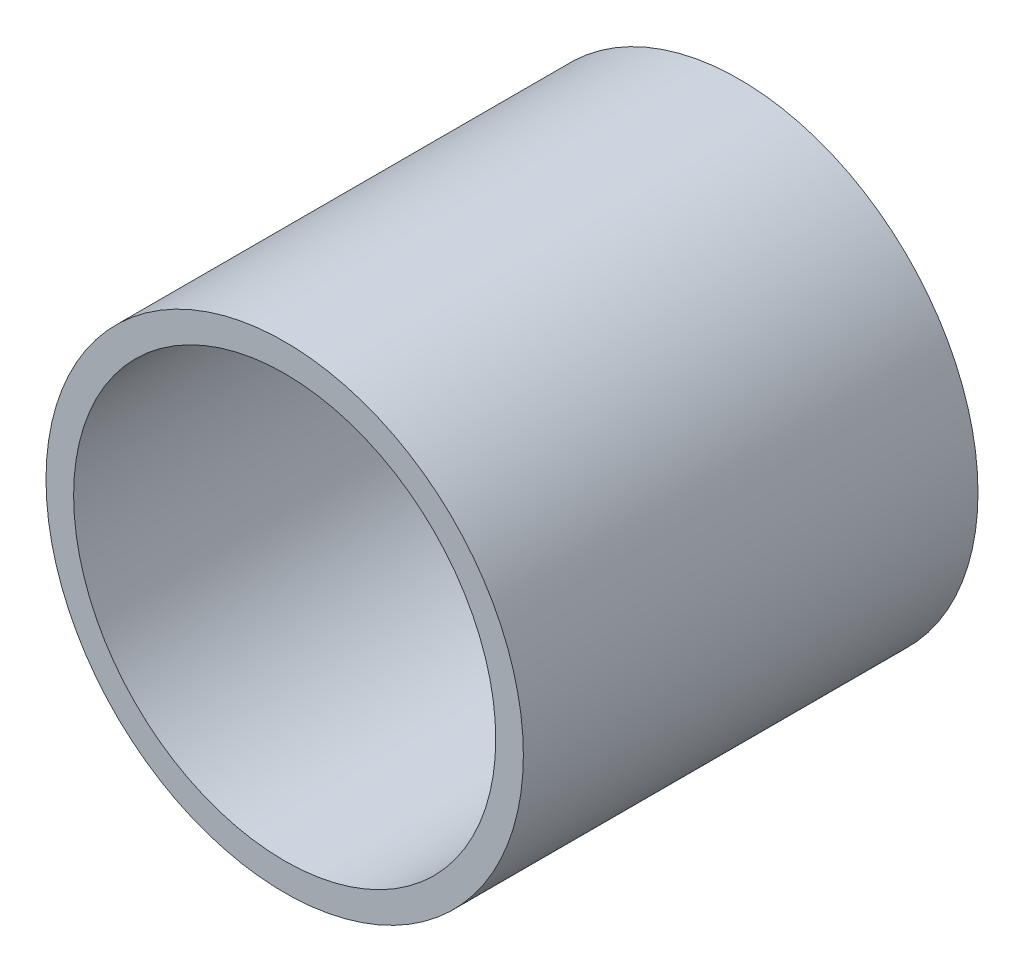
from build123d import *

# Parameters (mm, degrees)
SKETCH1_R           = 2.1
SKETCH1_R_2         = 1.857016922
BOSS_EXTRUDE1_DEPTH = 4


with BuildPart() as part:
    # Sketch1 → Boss-Extrude1 (new body)
    with BuildSketch(Plane.XY):
        Circle(SKETCH1_R)
        Circle(SKETCH1_R_2, mode=Mode.SUBTRACT)
    extrude(amount=BOSS_EXTRUDE1_DEPTH)


solid = part.part
